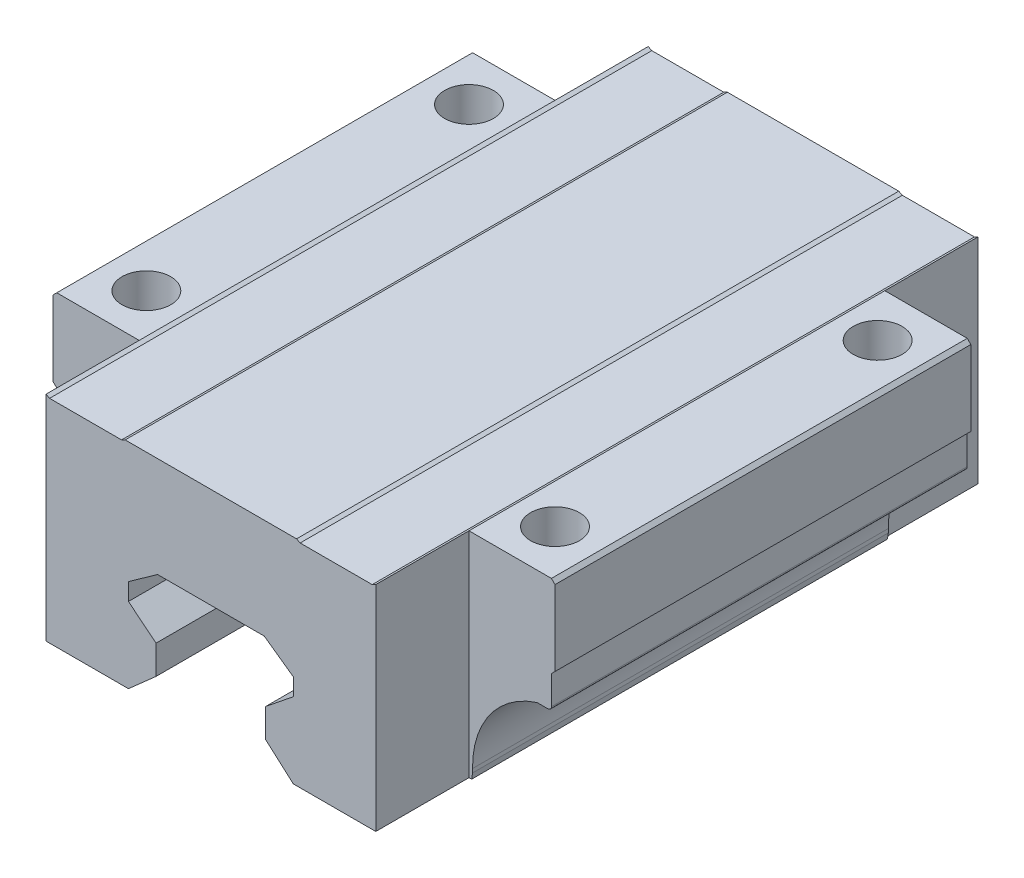
from build123d import *

# Parameters (mm, degrees)
EXTRUDE_1_DEPTH             = 42
EXTRUDE_2_DEPTH             = 29
EXTRUDE_2_2_DEPTH           = 29
HOLE_WIZARD_M8_1_AT_2_COUNT = 2
HOLE_WIZARD_M8_1_AT_2_PITCH = 45
HOLE_WIZARD_M8_1_AT_3_COUNT = 2
HOLE_WIZARD_M8_1_AT_3_PITCH = 72.622310621
HOLE_WIZARD_M8_1_AT_4_COUNT = 2
HOLE_WIZARD_M8_1_AT_4_PITCH = 57


with BuildPart() as part:
    # 草图1 → 凸台-拉伸1 (new, symmetric)
    with BuildSketch(Plane.XY):
        Polygon((-11.500091475, 5.734955537), (-7.647732558, 9.145638929), (-7.647727428, 13.16613519), (-11.50123169, 16.269719689), (-11.50123169, 18.669719689), (-7.435273395, 21.561714335), (7.43839537, 21.559493767), (11.50123169, 18.669719689), (11.50123169, 16.269719689), (7.647727428, 13.16613519), (7.647732558, 9.145638929), (11.500075136, 5.734970004), (22.999625955, 5.734825788), (23, 35.560596819), (22.5, 35.310596819), (12.447093803, 35.310596819), (11.947093803, 35.560596819), (-11.958571704, 35.560596819), (-12.458571704, 35.310596819), (-22.5, 35.310596819), (-23, 35.560596819), (-22.999625953, 5.734681137), align=None)
    extrude(amount=EXTRUDE_1_DEPTH, both=True)


with BuildPart() as body_2:
    # 草图1<5> → 凸台-拉伸2 (new, symmetric)
    with BuildSketch(Plane.XY):
        with BuildLine():
            Line((34.5, 35.560596819), (23, 35.560596819))
            Line((23, 35.560596819), (22.999625955, 5.734825788))
            Line((22.999625955, 5.734825788), (23.367770173, 5.734821171))
            Line((23.367770173, 5.734821171), (23.5, 6.560414048))
            Line((23.5, 6.560414048), (23.5, 7.09172117))
            ThreePointArc((23.5, 7.09172117), (25.930470263, 14.819939841), (32.5, 19.560596819))
            Line((32.5, 19.560596819), (34, 19.560596819))
            ThreePointArc((34, 19.560596819), (34.353553391, 19.707043429), (34.5, 20.060596819))
            Line((34.5, 20.060596819), (34.5, 24.060596819))
            Line((34.5, 24.060596819), (35, 24.560596819))
            Line((35, 24.560596819), (35, 35.060596819))
            Line((35, 35.060596819), (34.5, 35.560596819))
        make_face()
    extrude(amount=EXTRUDE_2_DEPTH, both=True)


with BuildPart() as body_3:
    # 草图1<5> → Extrude 2 2 (new, symmetric)
    with BuildSketch(Plane.XY):
        with BuildLine():
            Line((-23.367949599, 5.734672349), (-22.999625953, 5.734681137))
            Line((-22.999625953, 5.734681137), (-23, 35.560596819))
            Line((-23, 35.560596819), (-34.5, 35.560596819))
            Line((-34.5, 35.560596819), (-35, 35.060596819))
            Line((-35, 35.060596819), (-35, 24.560596819))
            Line((-35, 24.560596819), (-34.5, 24.060596819))
            Line((-34.5, 24.060596819), (-34.5, 20.060596819))
            ThreePointArc((-34.5, 20.060596819), (-34.353553391, 19.707043429), (-34, 19.560596819))
            Line((-34, 19.560596819), (-32.5, 19.560596819))
            ThreePointArc((-32.5, 19.560596819), (-25.930470263, 14.819939841), (-23.5, 7.09172117))
            Line((-23.5, 7.09172117), (-23.5, 6.560414048))
            Line((-23.5, 6.560414048), (-23.367949599, 5.734672349))
        make_face()
    extrude(amount=EXTRUDE_2_2_DEPTH, both=True)

    # 草图2 → M8 螺纹孔1 (revolve, cut)
    with BuildSketch(Plane(origin=(-28.5, 35.560596819, 22.5), x_dir=(0, 0, 1), z_dir=(1, 0, 0))):
        Polygon((0, 0), (0, 21.792926105), (3.4, 19.75), (3.4, 0), align=None)
    hole_wizard_m8_1 = revolve(axis=Axis((-28.5, 41.910596819, 22.5), (0, -1, 0)), mode=Mode.SUBTRACT)

    # M8 螺纹孔1 at 2: M8 螺纹孔1 ×2
    with Locations(*[(0, 0, -i * HOLE_WIZARD_M8_1_AT_2_PITCH) for i in range(1, HOLE_WIZARD_M8_1_AT_2_COUNT)]):
        add(hole_wizard_m8_1, mode=Mode.SUBTRACT)


with BuildPart() as body_2_1:
    add(body_2.part)

    # M8 螺纹孔1 at 3: M8 螺纹孔1 ×2
    with Locations(*[Vector(0.7848827655334262, 0, -0.6196442885790209) * (i * HOLE_WIZARD_M8_1_AT_3_PITCH) for i in range(1, HOLE_WIZARD_M8_1_AT_3_COUNT)]):
        add(hole_wizard_m8_1, mode=Mode.SUBTRACT)

    # M8 螺纹孔1 at 4: M8 螺纹孔1 ×2
    with Locations(*[(i * HOLE_WIZARD_M8_1_AT_4_PITCH, 0, 0) for i in range(1, HOLE_WIZARD_M8_1_AT_4_COUNT)]):
        add(hole_wizard_m8_1, mode=Mode.SUBTRACT)


solid = Compound([part.part, body_3.part, body_2_1.part])
